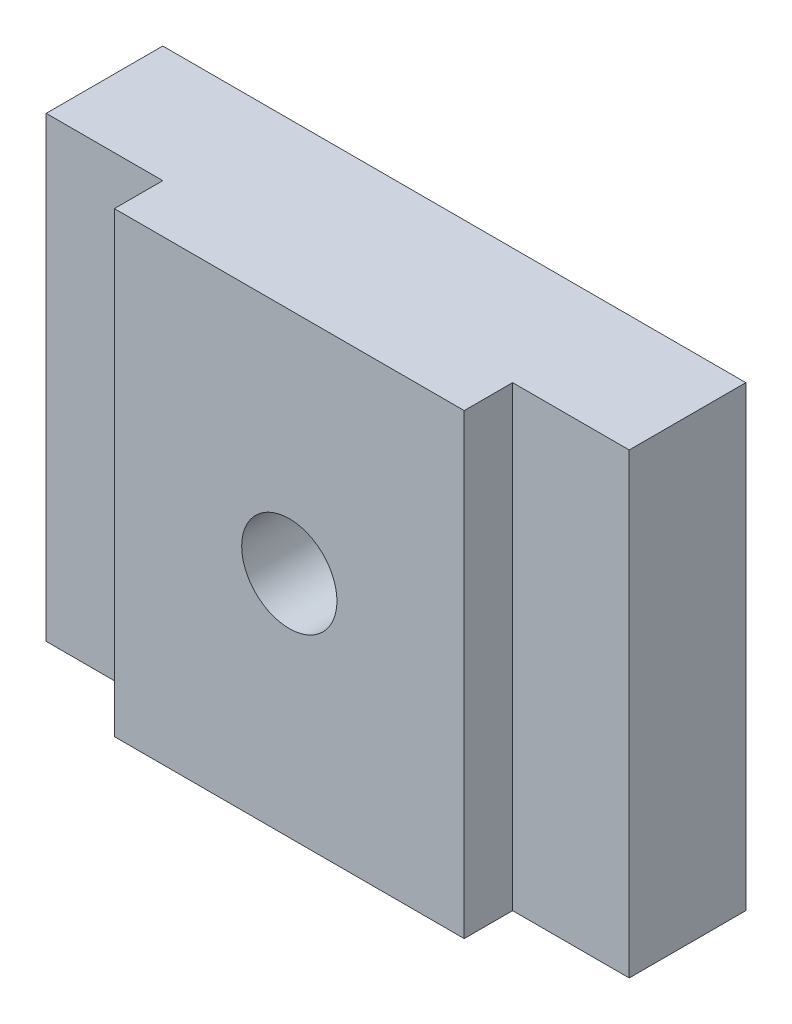
from build123d import *

# Parameters (mm, degrees)
BOSS_EXTRUDE1_DEPTH = 20
SKETCH2_R           = 2.0828
CUT_EXTRUDE1_DEPTH  = 25.791990194


with BuildPart() as part:
    # Sketch1 → Boss-Extrude1 (new body)
    with BuildSketch(Plane(origin=(0, 0, 0), x_dir=(1, 0, 0), z_dir=(0, 1, 0))):
        Polygon((7.65, 0), (-7.65, 0), (-7.65, 2.116666667), (-12.75, 2.116666667), (-12.75, 7.216666667), (12.75, 7.216666667), (12.75, 2.116666667), (7.65, 2.116666667), align=None)
    extrude(amount=BOSS_EXTRUDE1_DEPTH)

    # Sketch2 → Cut-Extrude1 (cut, through all)
    with BuildSketch(Plane(origin=(0, 0, -7.216666667), x_dir=(-1, 0, 0), z_dir=(0, 0, -1))):
        with Locations((0, 10)):
            Circle(SKETCH2_R)
    extrude(amount=-CUT_EXTRUDE1_DEPTH, mode=Mode.SUBTRACT)


solid = part.part
